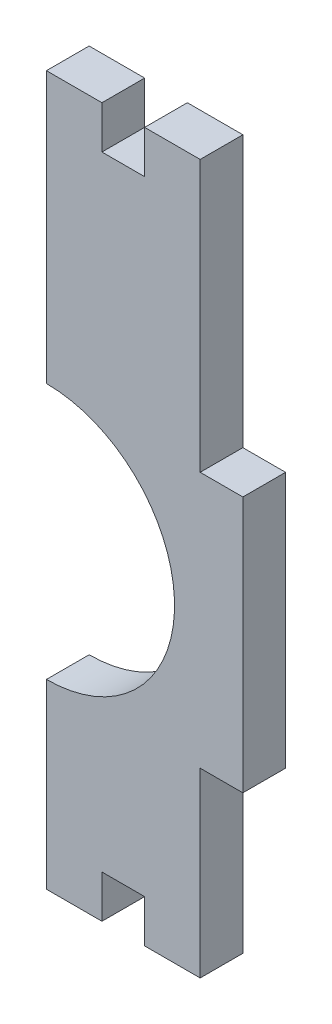
from build123d import *

# Parameters (mm, degrees)
BOSS_EXTRU_1_DEPTH      = 5
ESQUISSE2_W             = 5
ESQUISSE2_H             = 5
ENL_V_MAT_EXTRU_1_DEPTH = 5
ESQUISSE3_W             = 5
ESQUISSE3_H             = 30
BOSS_EXTRU_2_DEPTH      = 5


with BuildPart() as part:
    # Esquisse1 → Boss.-Extru.1 (new body)
    with BuildSketch(Plane.XY):
        with BuildLine():
            Line((-18, 35.436143593), (0, 35.436143593))
            Line((0, 35.436143593), (0, -47.563856407))
            Line((0, -47.563856407), (-18, -47.563856407))
            Line((-18, -47.563856407), (-18, -26.288856407))
            ThreePointArc((-18, -26.288856407), (-3, -11.288856407), (-18, 3.711143593))
            Line((-18, 3.711143593), (-18, 35.436143593))
        make_face()
    extrude(amount=BOSS_EXTRU_1_DEPTH)

    # Esquisse2 → Enlèv. mat.-Extru.1 (cut)
    with BuildSketch(Plane.XY.offset(5)):
        with Locations((-9, 32.936143593)):
            Rectangle(ESQUISSE2_W, ESQUISSE2_H)
        with Locations((-9, -45.063856407)):
            Rectangle(ESQUISSE2_W, ESQUISSE2_H)
    extrude(amount=-ENL_V_MAT_EXTRU_1_DEPTH, mode=Mode.SUBTRACT)

    # Esquisse3 → Boss.-Extru.2 (add)
    with BuildSketch(Plane.XY.offset(5)):
        with Locations((2.5, -11.288856407)):
            Rectangle(ESQUISSE3_W, ESQUISSE3_H)
    extrude(amount=-BOSS_EXTRU_2_DEPTH)


solid = part.part
